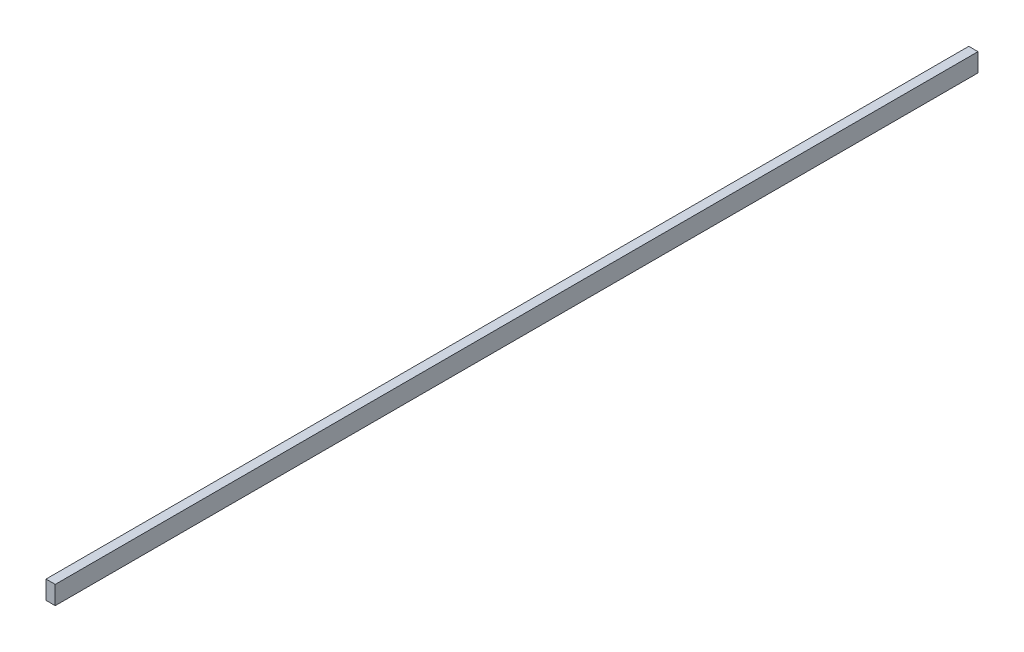
from build123d import *

# Parameters (mm, degrees)
BOSS_EXTRUDE1_DEPTH = 500


with BuildPart() as part:
    # Sketch1 → Boss-Extrude1 (new body)
    with BuildSketch(Plane.XY):
        Polygon((0, 10), (0, 0), (5, 0), (5, 5), (5, 10), align=None)
    extrude(amount=BOSS_EXTRUDE1_DEPTH)


solid = part.part
